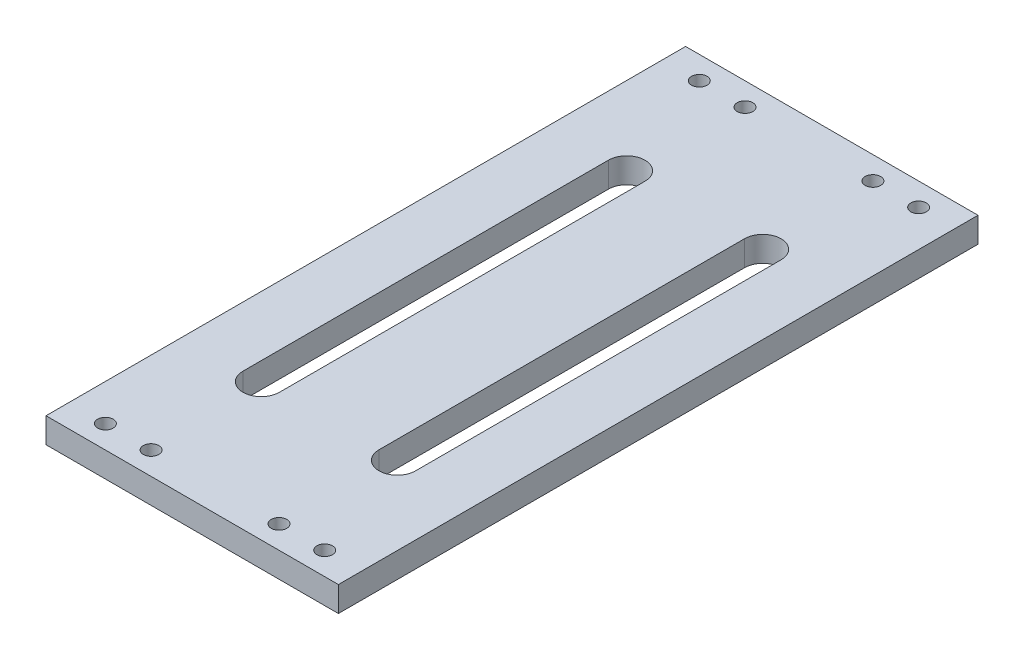
from build123d import *

# Parameters (mm, degrees)
SKETCH_5_W          = 64
SKETCH_5_H          = 140
EXTRUDE_4_DEPTH     = 2.75
SKETCH_6_R          = 1.7
CUT_EXTRUDE_1_DEPTH = 8
CUT_EXTRUDE_2_DEPTH = 10


with BuildPart() as part:
    # 草图5 → 凸台-拉伸4 (new, symmetric)
    with BuildSketch(Plane(origin=(0, 0, 0), x_dir=(1, 0, 0), z_dir=(0, 1, 0))):
        Rectangle(SKETCH_5_W, SKETCH_5_H)
    extrude(amount=EXTRUDE_4_DEPTH, both=True)

    # 草图6 → 切除-拉伸1 (cut)
    with BuildSketch(Plane(origin=(0, 2.75, 0), x_dir=(1, 0, 0), z_dir=(0, 1, 0))):
        with Locations(Location((-24, 65, 0), (0, 0, 270))):
            Circle(SKETCH_6_R)
        with Locations(Location((-24, -65, 0), (0, 0, 90))):
            Circle(SKETCH_6_R)
        with Locations(Location((24, -65, 0), (0, 0, 270))):
            Circle(SKETCH_6_R)
        with Locations(Location((24, 65, 0), (0, 0, 90))):
            Circle(SKETCH_6_R)
        with Locations(Location((-14, 65, 0), (0, 0, 270))):
            Circle(SKETCH_6_R)
        with Locations(Location((-14, -65, 0), (0, 0, 90))):
            Circle(SKETCH_6_R)
        with Locations(Location((14, -65, 0), (0, 0, 270))):
            Circle(SKETCH_6_R)
        with Locations(Location((14, 65, 0), (0, 0, 90))):
            Circle(SKETCH_6_R)
    extrude(amount=-CUT_EXTRUDE_1_DEPTH, mode=Mode.SUBTRACT)

    # 草图7 → 切除-拉伸2 (cut)
    with BuildSketch(Plane(origin=(0, 2.75, 0), x_dir=(1, 0, 0), z_dir=(0, 1, 0))):
        with BuildLine():
            Line((-10.893389513, 40), (-10.893389513, -40))
            ThreePointArc((-10.893389513, -40), (-14.893389513, -44), (-18.893389513, -40))
            Line((-18.893389513, -40), (-18.893389513, 40))
            ThreePointArc((-18.893389513, 40), (-14.893389513, 44), (-10.893389513, 40))
        make_face()
        with BuildLine():
            Line((10.893389513, 40), (10.893389513, -40))
            ThreePointArc((10.893389513, -40), (14.893389513, -44), (18.893389513, -40))
            Line((18.893389513, -40), (18.893389513, 40))
            ThreePointArc((18.893389513, 40), (14.893389513, 44), (10.893389513, 40))
        make_face()
    extrude(amount=-CUT_EXTRUDE_2_DEPTH, mode=Mode.SUBTRACT)


solid = part.part
